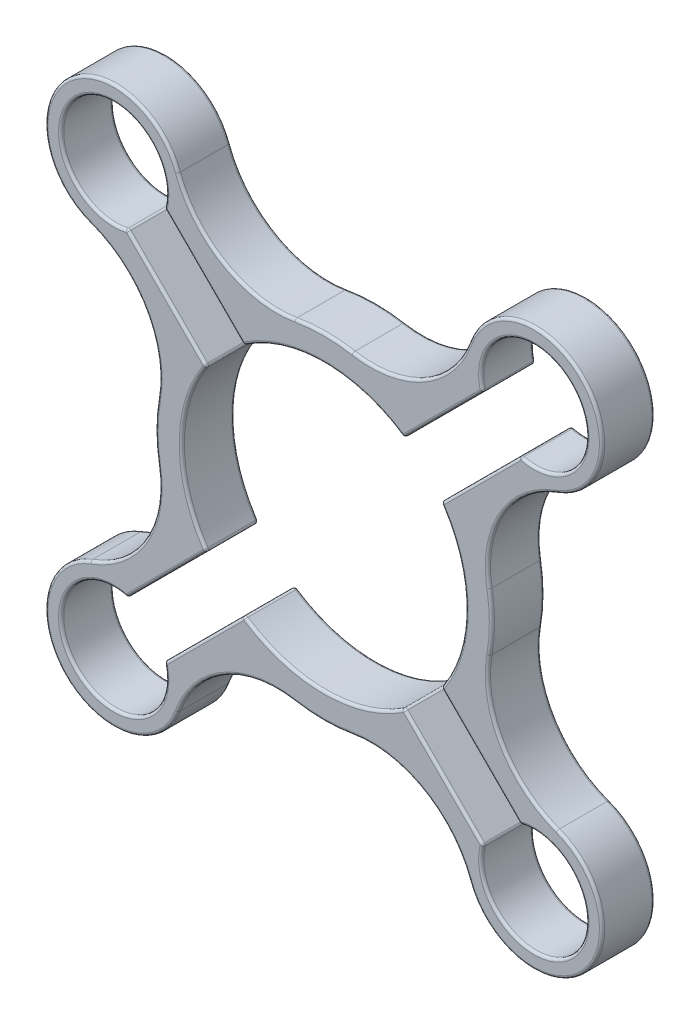
from build123d import *

# Parameters (mm, degrees)
BOSS_EXTRUDE1_DEPTH = 5
FILLET1_R           = 0.5


with BuildPart() as part:
    # Sketch1 → Boss-Extrude1 (new, symmetric)
    with BuildSketch(Plane.XY):
        with BuildLine():
            ThreePointArc((5.499886369, 31.523820357), (0, 32), (-5.499886369, 31.523820357))
            ThreePointArc((-5.499886369, 31.523820357), (-18.956279365, 33.916662735), (-27.733810979, 44.393071751))
            ThreePointArc((-27.733810979, 44.393071751), (-49.143921292, 49.143921292), (-44.393071751, 27.733810979))
            ThreePointArc((-44.393071751, 27.733810979), (-33.916662735, 18.956279365), (-31.523820357, 5.499886369))
            ThreePointArc((-31.523820357, 5.499886369), (-32, 0), (-31.523820357, -5.499886369))
            ThreePointArc((-31.523820357, -5.499886369), (-33.916662735, -18.956279365), (-44.393071751, -27.733810979))
            ThreePointArc((-44.393071751, -27.733810979), (-49.143921292, -49.143921292), (-27.733810979, -44.393071751))
            ThreePointArc((-27.733810979, -44.393071751), (-18.956279365, -33.916662735), (-5.499886369, -31.523820357))
            ThreePointArc((-5.499886369, -31.523820357), (0, -32), (5.499886369, -31.523820357))
            ThreePointArc((5.499886369, -31.523820357), (18.956279365, -33.916662735), (27.733810979, -44.393071751))
            ThreePointArc((27.733810979, -44.393071751), (49.143921292, -49.143921292), (44.393071751, -27.733810979))
            ThreePointArc((44.393071751, -27.733810979), (33.916662735, -18.956279365), (31.523820357, -5.499886369))
            ThreePointArc((31.523820357, -5.499886369), (32, 0), (31.523820357, 5.499886369))
            ThreePointArc((31.523820357, 5.499886369), (33.916662735, 18.956279365), (44.393071751, 27.733810979))
            ThreePointArc((44.393071751, 27.733810979), (49.143921292, 49.143921292), (27.733810979, 44.393071751))
            ThreePointArc((27.733810979, 44.393071751), (18.956279365, 33.916662735), (5.499886369, 31.523820357))
        make_face()
        with BuildLine():
            Line((33.728792929, 26.657725117), (25.885030545, 18.813962733))
            Line((25.885030545, 18.813962733), (22.297196945, 15.226129133))
            ThreePointArc((22.297196945, 15.226129133), (27, 0), (22.297196945, -15.226129133))
            Line((22.297196945, -15.226129133), (25.885030545, -18.813962733))
            Line((25.885030545, -18.813962733), (33.728792929, -26.657725117))
            Line((33.728792929, -26.657725117), (37.363342686, -30.292274874))
            ThreePointArc((37.363342686, -30.292274874), (47.022600949, -47.022600949), (30.292274874, -37.363342686))
            Line((30.292274874, -37.363342686), (26.657725117, -33.728792929))
            Line((26.657725117, -33.728792929), (18.813962733, -25.885030545))
            Line((18.813962733, -25.885030545), (15.226129133, -22.297196945))
            ThreePointArc((15.226129133, -22.297196945), (0, -27), (-15.226129133, -22.297196945))
            Line((-15.226129133, -22.297196945), (-18.813962733, -25.885030545))
            Line((-18.813962733, -25.885030545), (-26.657725117, -33.728792929))
            Line((-26.657725117, -33.728792929), (-30.292274874, -37.363342686))
            ThreePointArc((-30.292274874, -37.363342686), (-47.022600949, -47.022600949), (-37.363342686, -30.292274874))
            Line((-37.363342686, -30.292274874), (-33.728792929, -26.657725117))
            Line((-33.728792929, -26.657725117), (-25.885030545, -18.813962733))
            Line((-25.885030545, -18.813962733), (-22.297196945, -15.226129133))
            ThreePointArc((-22.297196945, -15.226129133), (-27, 0), (-22.297196945, 15.226129133))
            Line((-22.297196945, 15.226129133), (-25.885030545, 18.813962733))
            Line((-25.885030545, 18.813962733), (-33.728792929, 26.657725117))
            Line((-33.728792929, 26.657725117), (-37.363342686, 30.292274874))
            ThreePointArc((-37.363342686, 30.292274874), (-47.022600949, 47.022600949), (-30.292274874, 37.363342686))
            Line((-30.292274874, 37.363342686), (-26.657725117, 33.728792929))
            Line((-26.657725117, 33.728792929), (-18.813962733, 25.885030545))
            Line((-18.813962733, 25.885030545), (-15.226129133, 22.297196945))
            ThreePointArc((-15.226129133, 22.297196945), (0, 27), (15.226129133, 22.297196945))
            Line((15.226129133, 22.297196945), (18.813962733, 25.885030545))
            Line((18.813962733, 25.885030545), (26.657725117, 33.728792929))
            Line((26.657725117, 33.728792929), (30.292274874, 37.363342686))
            ThreePointArc((30.292274874, 37.363342686), (47.022600949, 47.022600949), (37.363342686, 30.292274874))
            Line((37.363342686, 30.292274874), (33.728792929, 26.657725117))
        make_face(mode=Mode.SUBTRACT)
    extrude(amount=BOSS_EXTRUDE1_DEPTH, both=True)

    # Fillet1
    fillet1_edges = [part.edges().sort_by_distance(p)[0] for p in [
        (-18.956279365, 33.916662735, 5),
        (49.143921292, 49.143921292, -5),
        (33.916662735, 18.956279365, -5),
        (32, 0, -5),
        (-49.143921292, 49.143921292, 5),
        (33.916662735, -18.956279365, -5),
        (49.143921292, -49.143921292, -5),
        (18.956279365, -33.916662735, -5),
        (0, -32, -5),
        (-18.956279365, -33.916662735, -5),
        (-49.143921292, -49.143921292, -5),
        (-33.916662735, -18.956279365, -5),
        (-32, 0, -5),
        (-33.916662735, 18.956279365, -5),
        (-49.143921292, 49.143921292, -5),
        (-33.916662735, 18.956279365, 5),
        (-18.956279365, 33.916662735, -5),
        (0, 32, -5),
        (18.956279365, 33.916662735, -5),
        (-32, 0, 5),
        (-33.916662735, -18.956279365, 5),
        (-49.143921292, -49.143921292, 5),
        (-18.956279365, -33.916662735, 5),
        (0, -32, 5),
        (18.956279365, -33.916662735, 5),
        (49.143921292, -49.143921292, 5),
        (18.956279365, 33.916662735, 5),
        (0, 27, -5),
        (15.226129133, 22.297196945, 0),
        (-22.759202004, 29.830269816, -5),
        (33.916662735, -18.956279365, 5),
        (-15.226129133, 22.297196945, 0),
        (-47.022600949, 47.022600949, -5),
        (-30.292274874, 37.363342686, 0),
        (-29.830269816, 22.759202004, -5),
        (-37.363342686, 30.292274874, 0),
        (-27, 0, -5),
        (-22.297196945, 15.226129133, 0),
        (-29.830269816, -22.759202004, -5),
        (-22.297196945, -15.226129133, 0),
        (-47.022600949, -47.022600949, -5),
        (-37.363342686, -30.292274874, 0),
        (-22.759202004, -29.830269816, -5),
        (32, 0, 5),
        (-30.292274874, -37.363342686, 0),
        (0, -27, -5),
        (-15.226129133, -22.297196945, 0),
        (22.759202004, -29.830269816, -5),
        (15.226129133, -22.297196945, 0),
        (47.022600949, -47.022600949, -5),
        (30.292274874, -37.363342686, 0),
        (29.830269816, -22.759202004, -5),
        (37.363342686, -30.292274874, 0),
        (27, 0, -5),
        (22.297196945, -15.226129133, 0),
        (29.830269816, 22.759202004, -5),
        (22.297196945, 15.226129133, 0),
        (47.022600949, 47.022600949, -5),
        (33.916662735, 18.956279365, 5),
        (37.363342686, 30.292274874, 0),
        (22.759202004, 29.830269816, -5),
        (30.292274874, 37.363342686, 0),
        (0, 27, 5),
        (-22.759202004, 29.830269816, 5),
        (-47.022600949, 47.022600949, 5),
        (-29.830269816, 22.759202004, 5),
        (-27, 0, 5),
        (-29.830269816, -22.759202004, 5),
        (49.143921292, 49.143921292, 5),
        (-47.022600949, -47.022600949, 5),
        (-22.759202004, -29.830269816, 5),
        (0, -27, 5),
        (22.759202004, -29.830269816, 5),
        (47.022600949, -47.022600949, 5),
        (29.830269816, -22.759202004, 5),
        (27, 0, 5),
        (29.830269816, 22.759202004, 5),
        (47.022600949, 47.022600949, 5),
        (22.759202004, 29.830269816, 5),
        (0, 32, 5),
    ]]
    fillet(fillet1_edges, radius=FILLET1_R)


solid = part.part
